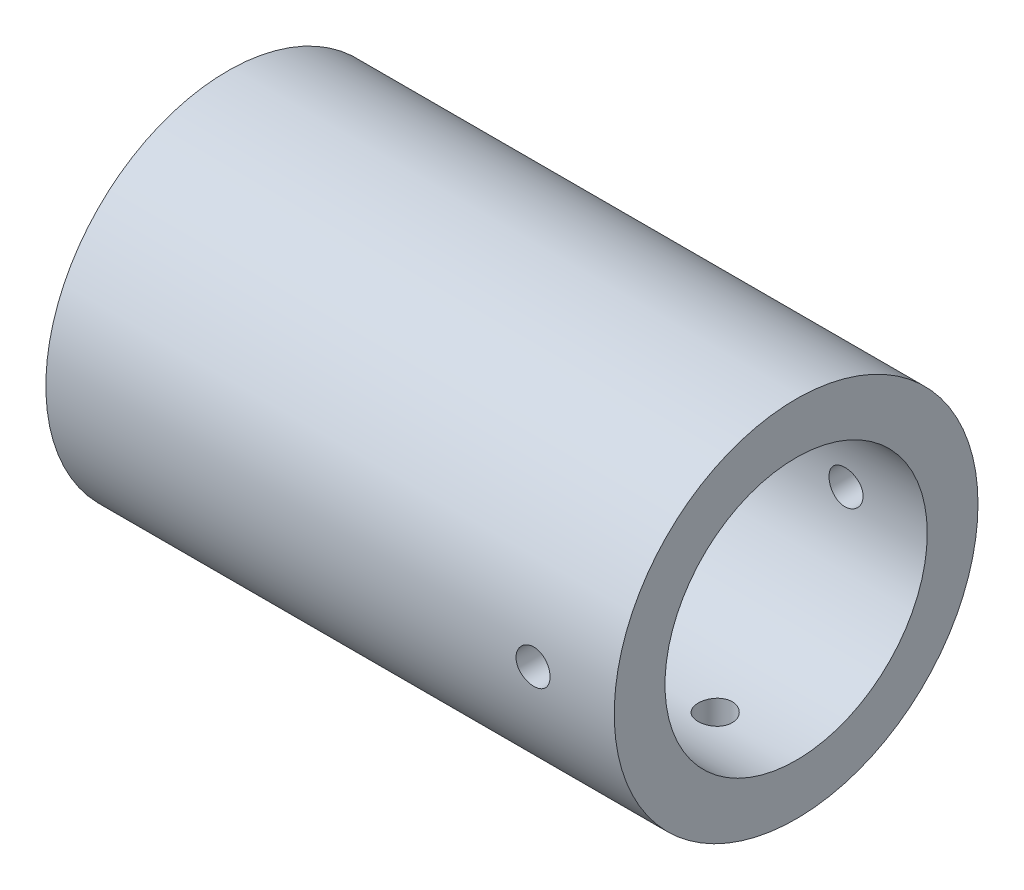
from build123d import *

# Parameters (mm, degrees)
SKETCH1_R             = 22.4
EXTRUDE1_DEPTH        = 70
SKETCH2_R             = 16.15
EXTRUDE2_DEPTH        = 64
SKETCH3_R             = 5
EXTRUDE3_DEPTH        = 10
EXTRUDE5_DEPTH        = 30
M5_TAPPED_HOLE3_D     = 4.2
M5_TAPPED_HOLE5_D     = 4.2
M5_TAPPED_HOLE5_DEPTH = 14
M5_TAPPED_HOLE5_TIP   = 1.2618073
M4_TAPPED_HOLE1_D     = 3.3
M4_TAPPED_HOLE1_DEPTH = 11.5
M4_TAPPED_HOLE1_TIP   = 0.991420021


with BuildPart() as part:
    # Sketch1 → Extrude1 (new body)
    with BuildSketch(Plane(origin=(0, 0, 0), x_dir=(0, 0, -1), z_dir=(1, 0, 0))):
        Circle(SKETCH1_R)
    extrude(amount=EXTRUDE1_DEPTH)

    # Sketch2 → Extrude2 (cut)
    with BuildSketch(Plane(origin=(70, 0, 0), x_dir=(0, 0, -1), z_dir=(1, 0, 0))):
        Circle(SKETCH2_R)
    extrude(amount=-EXTRUDE2_DEPTH, mode=Mode.SUBTRACT)

    # Sketch3 → Extrude3 (cut)
    with BuildSketch(Plane.ZY):
        Circle(SKETCH3_R)
    extrude(amount=-EXTRUDE3_DEPTH, mode=Mode.SUBTRACT)

    # Sketch7 → Extrude5 (cut)
    with BuildSketch(Plane(origin=(0, 0, 0), x_dir=(1, 0, 0), z_dir=(0, 1, 0))):
        with BuildLine():
            Line((9, 12.5), (43, 12.5))
            ThreePointArc((43, 12.5), (45.121320344, 11.621320344), (46, 9.5))
            Line((46, 9.5), (46, -9.5))
            ThreePointArc((46, -9.5), (45.121320344, -11.621320344), (43, -12.5))
            Line((43, -12.5), (9, -12.5))
            ThreePointArc((9, -12.5), (6.878679656, -11.621320344), (6, -9.5))
            Line((6, -9.5), (6, 9.5))
            ThreePointArc((6, 9.5), (6.878679656, 11.621320344), (9, 12.5))
        make_face()
    extrude(amount=-EXTRUDE5_DEPTH, mode=Mode.SUBTRACT)

    # M5 Tapped Hole3 (through all)
    with Locations(Plane(origin=(60, 0, 22.4), x_dir=(1, 0, 0), z_dir=(0, 0, 1))):
        with Locations((0, 0)):
            Hole(M5_TAPPED_HOLE3_D / 2)

    # M5 Tapped Hole5
    with Locations(Plane(origin=(59.947350676, -16.149783021, -0.083715942), x_dir=(0, -0.005183649651, 0.999986564798), z_dir=(0, 0.999986564798, 0.005183649651))):
        with Locations((0, 0)):
            Hole(M5_TAPPED_HOLE5_D / 2, depth=M5_TAPPED_HOLE5_DEPTH)
            with Locations((0, 0, -(M5_TAPPED_HOLE5_DEPTH + M5_TAPPED_HOLE5_TIP / 2))):  # 118° drill point
                Cone(0, M5_TAPPED_HOLE5_D / 2, M5_TAPPED_HOLE5_TIP, mode=Mode.SUBTRACT)

    # M4 Tapped Hole1
    with Locations(Plane(origin=(0, 0, -15.027388536), x_dir=(0, 0, -1), z_dir=(-1, 0, 0))):
        with Locations((0, 0), (-15.027388536, -15), (-30.027388536, 0), (-15.027388536, 15)):
            Hole(M4_TAPPED_HOLE1_D / 2, depth=M4_TAPPED_HOLE1_DEPTH)
            with Locations((0, 0, -(M4_TAPPED_HOLE1_DEPTH + M4_TAPPED_HOLE1_TIP / 2))):  # 118° drill point
                Cone(0, M4_TAPPED_HOLE1_D / 2, M4_TAPPED_HOLE1_TIP, mode=Mode.SUBTRACT)


solid = part.part
